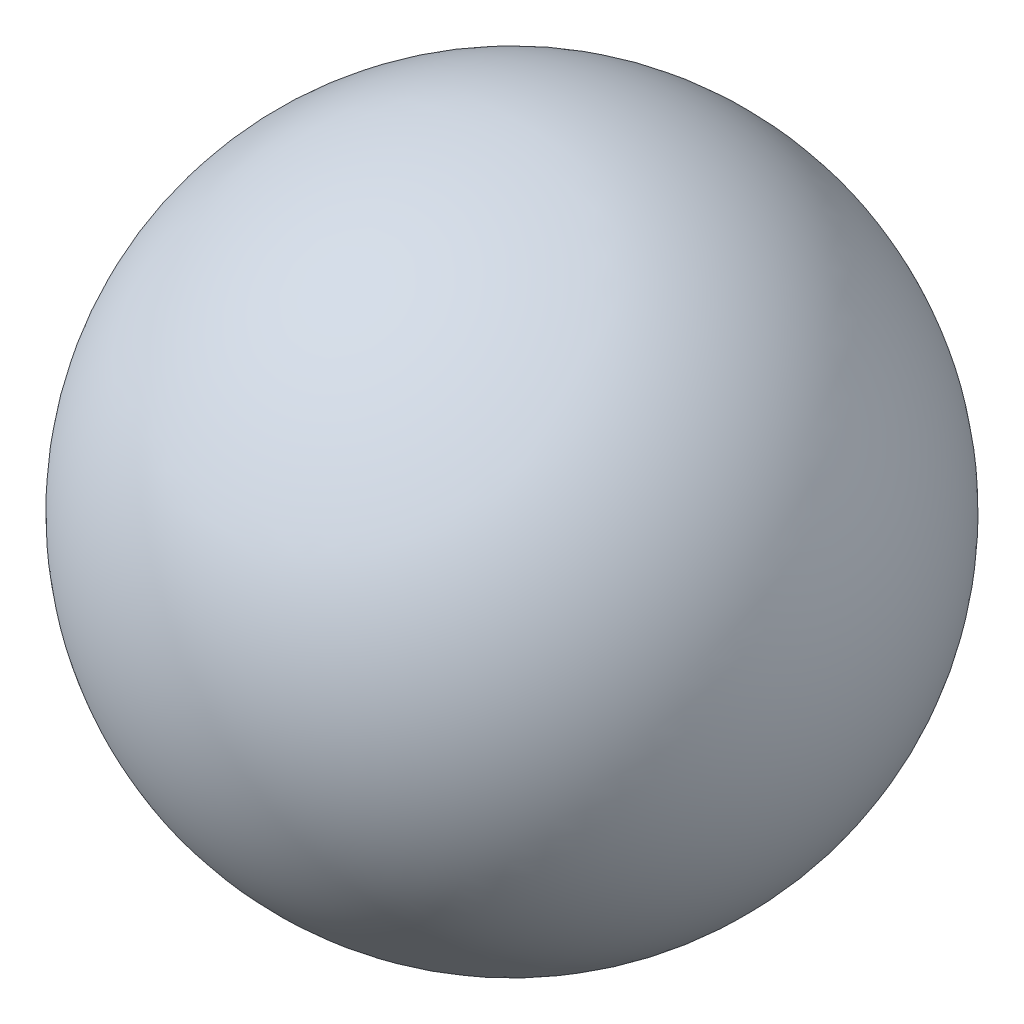
from build123d import *


with BuildPart() as part:
    # Эскиз1 → Повернуть1 (revolve)
    with BuildSketch(Plane(origin=(0, 0, 0), x_dir=(1, 0, 0), z_dir=(0, 1, 0))):
        with BuildLine():
            Line((0, 100), (0, 94.2))
            ThreePointArc((0, 94.2), (94.2, 0), (0, -94.2))
            Line((0, -94.2), (0, -100))
            ThreePointArc((0, -100), (100, 0), (0, 100))
        make_face()
    revolve(axis=Axis((0, 0, -100), (0, 0, 1)))


solid = part.part
